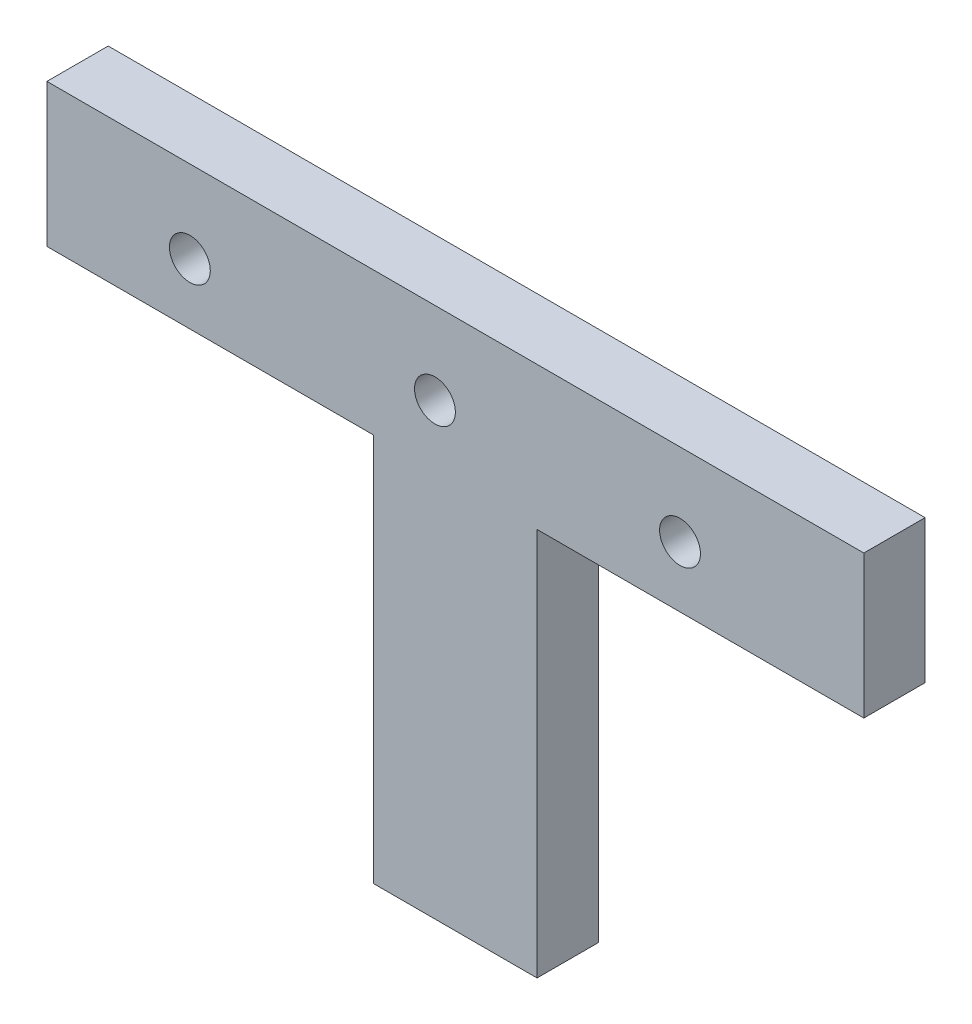
from build123d import *

# Parameters (mm, degrees)
EXTRUDE_1_DEPTH     = 15
SKETCH_2_R          = 5
CUT_EXTRUDE_1_DEPTH = 212.504412291


with BuildPart() as part:
    # 草圖1 → 填料-伸長1 (new body)
    with BuildSketch(Plane.XY):
        Polygon((-40.155141061, 7.219614063), (-80.155141061, 7.219614063), (-80.155141061, 102.329702578), (-160.155141061, 102.329702578), (-160.155141061, 137.329702578), (39.844858939, 137.329702578), (39.844858939, 102.329702578), (-40.155141061, 102.329702578), align=None)
    extrude(amount=EXTRUDE_1_DEPTH)

    # 草圖2 → 除料-伸長1 (cut, through all)
    with BuildSketch(Plane.XY.offset(15)):
        with Locations((-5.155141061, 117.189491535)):
            Circle(SKETCH_2_R)
        with Locations((-65.155141061, 117.189491535)):
            Circle(SKETCH_2_R)
        with Locations((-125.155141061, 117.189491535)):
            Circle(SKETCH_2_R)
    extrude(amount=-CUT_EXTRUDE_1_DEPTH, mode=Mode.SUBTRACT)


solid = part.part
